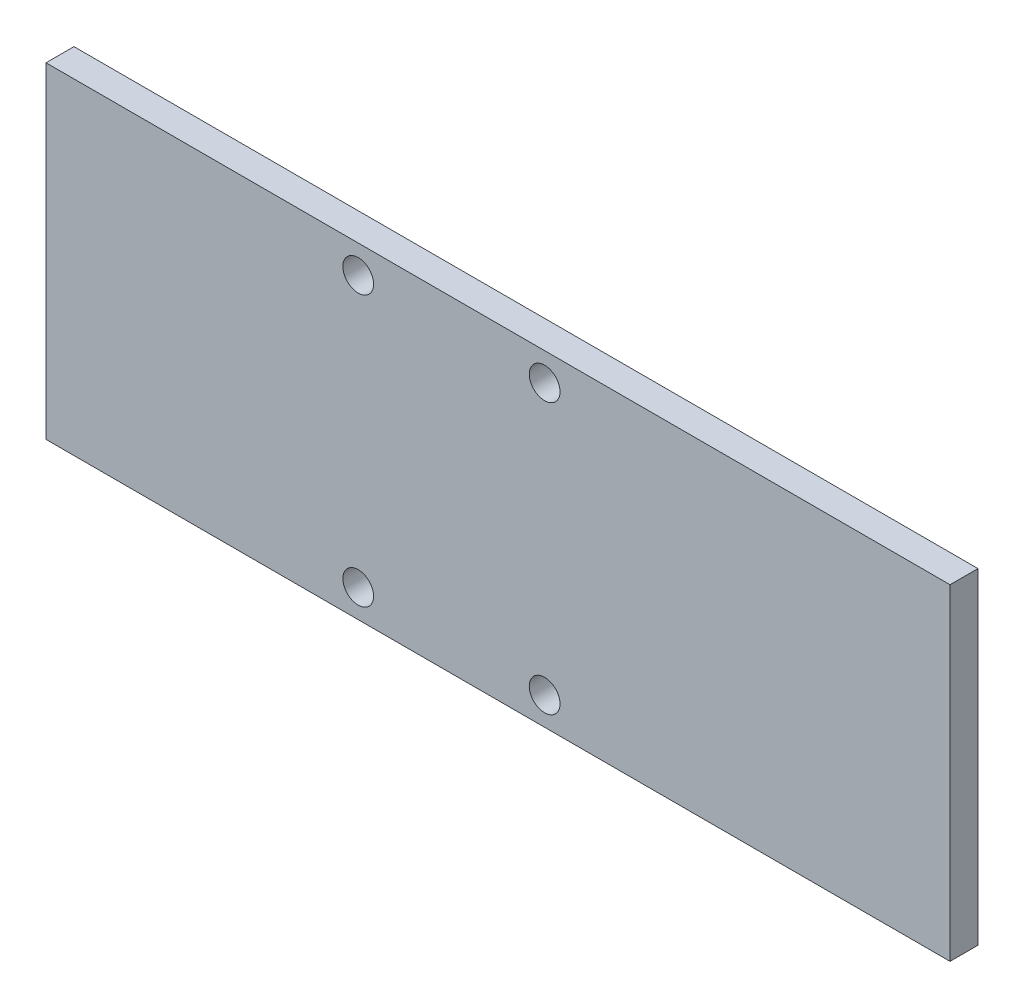
from build123d import *

# Parameters (mm, degrees)
SKETCH_1_W          = 97
SKETCH_1_H          = 35
EXTRUDE_1_DEPTH     = 3
SKETCH_2_R          = 1.65
CUT_EXTRUDE_1_DEPTH = 3


with BuildPart() as part:
    # 草图1 → 凸台-拉伸1 (new body)
    with BuildSketch(Plane.XY):
        Rectangle(SKETCH_1_W, SKETCH_1_H)
    extrude(amount=EXTRUDE_1_DEPTH)

    # 草图2 → 切除-拉伸1 (cut)
    with BuildSketch(Plane(origin=(0, 0, 0), x_dir=(-1, 0, 0), z_dir=(0, 0, -1))):
        with Locations((-5, -14.5)):
            Circle(SKETCH_2_R)
        with Locations((15, -14.5)):
            Circle(SKETCH_2_R)
        with Locations((-5, 14.5)):
            Circle(SKETCH_2_R)
        with Locations((15, 14.5)):
            Circle(SKETCH_2_R)
    extrude(amount=-CUT_EXTRUDE_1_DEPTH, mode=Mode.SUBTRACT)


solid = part.part
